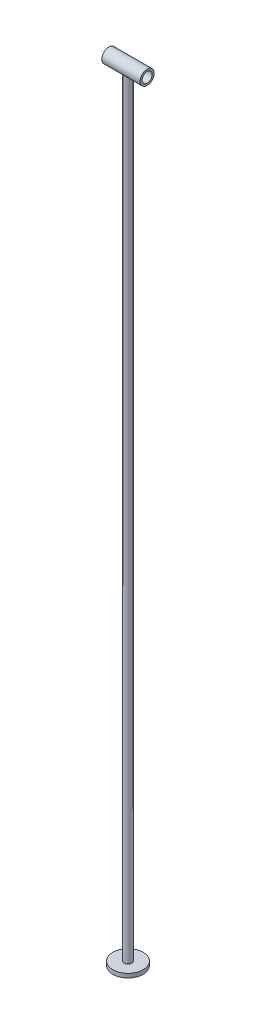
from build123d import *

# Parameters (mm, degrees)
KLIP_SKETCH1_R                = 75
KLIP_BOSS_EXTRUDE1_DEPTH      = 20
KLIP_BOSS_EXTRUDE3_DEPTH      = 95
KLIP_BOSS_EXTRUDE3_DEPTH_BACK = 95
KLIP_SKETCH3_R                = 35
KLIP_SKETCH3_R_2              = 25
KLIP_BOSS_EXTRUDE2_REACH      = 3873.892
KLIP_BOSS_EXTRUDE2_END_RADIUS = 35
KLIP_SKETCH2_R                = 18.75


with BuildPart() as part:
    # klip_Sketch1 → klip_Boss-Extrude1 (new body)
    with BuildSketch(Plane(origin=(0, 0, 0), x_dir=(1, 0, 0), z_dir=(0, 1, 0))):
        Circle(KLIP_SKETCH1_R)
    extrude(amount=-KLIP_BOSS_EXTRUDE1_DEPTH)

    # klip_Boss-Extrude2: up to this cylinder (the profile starts outside it)
    klip_boss_extrude2_end = Plane(origin=(0, 3835, 0), z_dir=(1, 0, 0)) * Cylinder(KLIP_BOSS_EXTRUDE2_END_RADIUS, 7818.784, mode=Mode.PRIVATE)
    # klip_Sketch2 → klip_Boss-Extrude2 (add, up to the surface)
    with BuildSketch(Plane(origin=(0, 0, 0), x_dir=(1, 0, 0), z_dir=(0, 1, 0)), mode=Mode.PRIVATE) as klip_boss_extrude2_sk1:
        Circle(KLIP_SKETCH2_R)
    klip_boss_extrude2_tool1 = extrude(klip_boss_extrude2_sk1.sketch, amount=KLIP_BOSS_EXTRUDE2_REACH, mode=Mode.PRIVATE) - klip_boss_extrude2_end
    add(klip_boss_extrude2_tool1.solids().sort_by_distance((0, 0, 0))[0])


with BuildPart() as body_2:
    # klip_Sketch3 → klip_Boss-Extrude3 (new, two sides: drawn at the far end of the back side and taken through both)
    with BuildSketch(Plane(origin=(0, 0, 0), x_dir=(0, 0, -1), z_dir=(1, 0, 0)).offset(-KLIP_BOSS_EXTRUDE3_DEPTH_BACK)):
        with Locations((0, 3835)):
            Circle(KLIP_SKETCH3_R)
        with Locations((0, 3835)):
            Circle(KLIP_SKETCH3_R_2, mode=Mode.SUBTRACT)
    extrude(amount=KLIP_BOSS_EXTRUDE3_DEPTH + KLIP_BOSS_EXTRUDE3_DEPTH_BACK)


solid = Compound([part.part, body_2.part])
